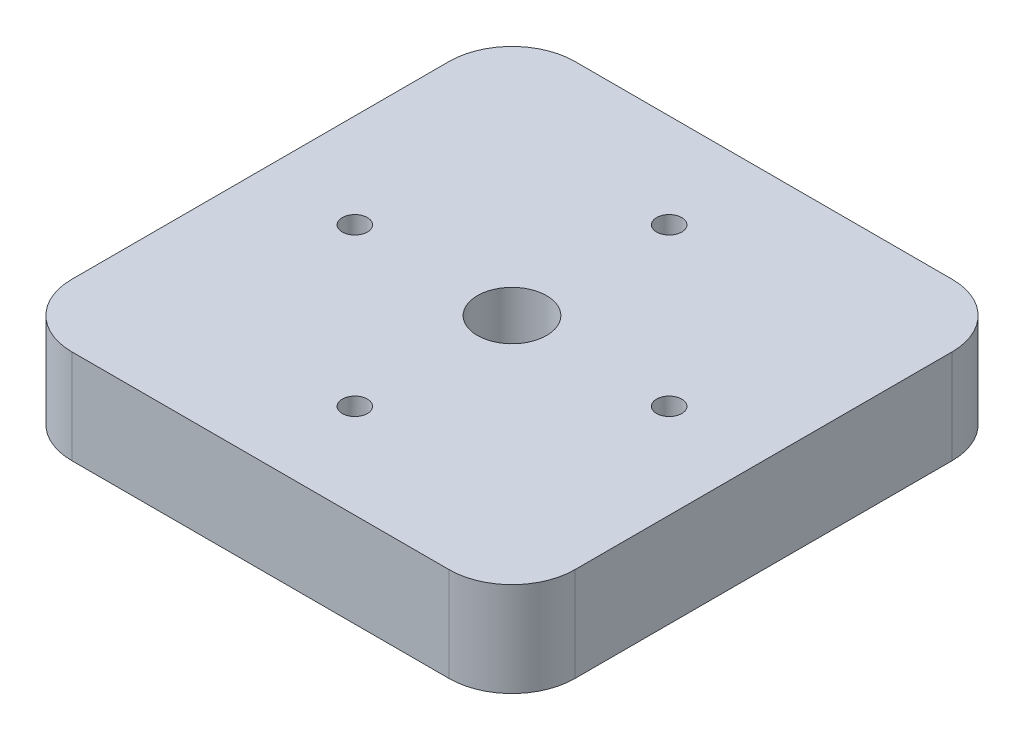
from build123d import *

# Parameters (mm, degrees)
SKETCH1_R           = 7
SKETCH1_R_2         = 2
BOSS_EXTRUDE1_DEPTH = 15
BOSS_EXTRUDE2_START = -8
SKETCH2_R           = 7
SKETCH2_R_2         = 5.5
BOSS_EXTRUDE2_DEPTH = 8


with BuildPart() as part:
    # Sketch1 → Boss-Extrude1 (new body)
    with BuildSketch(Plane(origin=(0, 0, 0), x_dir=(1, 0, 0), z_dir=(0, 1, 0))):
        with BuildLine():
            Line((-30, 40), (30, 40))
            ThreePointArc((30, 40), (37.071067812, 37.071067812), (40, 30))
            Line((40, 30), (40, -30))
            ThreePointArc((40, -30), (37.071067812, -37.071067812), (30, -40))
            Line((30, -40), (-30, -40))
            ThreePointArc((-30, -40), (-37.071067812, -37.071067812), (-40, -30))
            Line((-40, -30), (-40, 30))
            ThreePointArc((-40, 30), (-37.071067812, 37.071067812), (-30, 40))
        make_face()
        with Locations(Location((0, 0, 0), (0, 0, 270))):
            Circle(SKETCH1_R, mode=Mode.SUBTRACT)
        with Locations(Location((0, 25, 0), (0, 0, 270))):
            Circle(SKETCH1_R_2, mode=Mode.SUBTRACT)
        with Locations(Location((0, -25, 0), (0, 0, 270))):
            Circle(SKETCH1_R_2, mode=Mode.SUBTRACT)
        with Locations(Location((-25, 0, 0), (0, 0, 270))):
            Circle(SKETCH1_R_2, mode=Mode.SUBTRACT)
        with Locations(Location((25, 0, 0), (0, 0, 270))):
            Circle(SKETCH1_R_2, mode=Mode.SUBTRACT)
    extrude(amount=BOSS_EXTRUDE1_DEPTH)

    # Sketch2 → Boss-Extrude2 (add)
    with BuildSketch(Plane(origin=(0, 15, 0), x_dir=(1, 0, 0), z_dir=(0, 1, 0)).offset(BOSS_EXTRUDE2_START)):
        with Locations(Location((0, 0, 0), (0, 0, 270))):
            Circle(SKETCH2_R)
        with Locations(Location((0, 0, 0), (0, 0, 270))):
            Circle(SKETCH2_R_2, mode=Mode.SUBTRACT)
    extrude(amount=BOSS_EXTRUDE2_DEPTH)


solid = part.part
